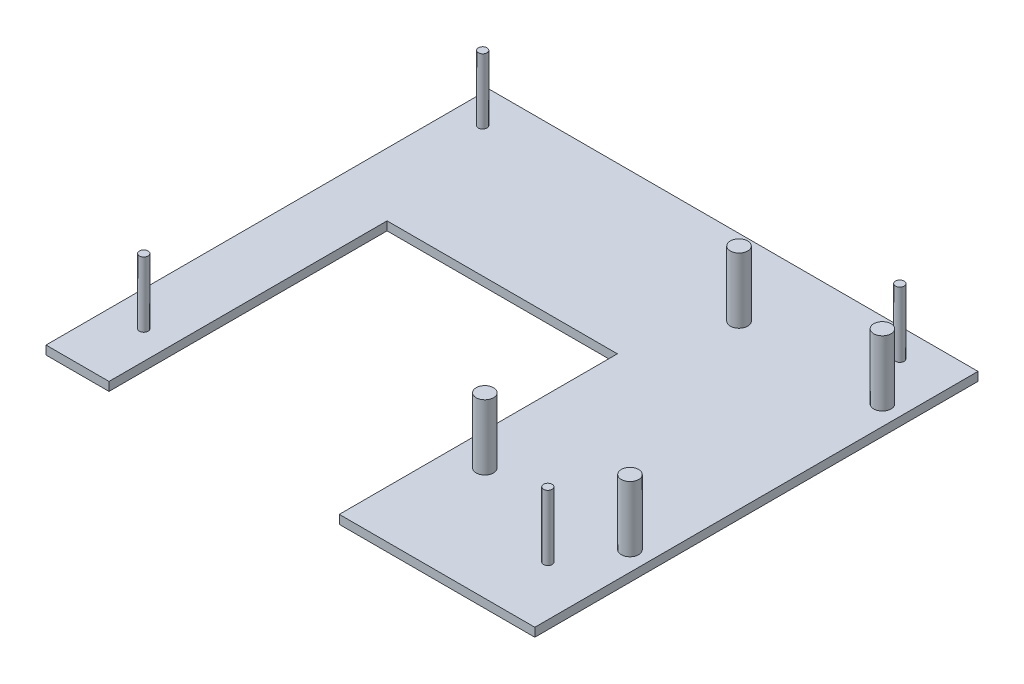
from build123d import *

# Parameters (mm, degrees)
SKETCH_1_W          = 120
SKETCH_1_H          = 120
EXTRUDE_1_DEPTH     = 2
SKETCH_2_R          = 2
SKETCH_2_R_2        = 1
EXTRUDE_2_DEPTH     = 15
SKETCH_3_W          = 53
SKETCH_3_H          = 18
SKETCH_3_W_2        = 45
SKETCH_3_W_3        = 14.5
SKETCH_3_W_4        = 7.5
SKETCH_3_H_2        = 13
SKETCH_3_H_3        = 89
CUT_EXTRUDE_3_DEPTH = 15
SKETCH_4_W          = 53
SKETCH_4_H          = 64
CUT_EXTRUDE_4_DEPTH = 15


with BuildPart() as part:
    # 스케치1 → 보스-돌출1 (new body)
    with BuildSketch(Plane(origin=(0, 0, 0), x_dir=(1, 0, 0), z_dir=(0, 1, 0))):
        Rectangle(SKETCH_1_W, SKETCH_1_H)
    extrude(amount=EXTRUDE_1_DEPTH)

    # 스케치2 → 보스-돌출2 (add)
    with BuildSketch(Plane(origin=(0, 2, 0), x_dir=(1, 0, 0), z_dir=(0, 1, 0))):
        with Locations(Location((55.5, 24.5, 0), (0, 0, 270))):
            Circle(SKETCH_2_R)
        with Locations(Location((55.5, -33.6, 0), (0, 0, 270))):
            Circle(SKETCH_2_R)
        with Locations(Location((48.5, -45.5, 0), (0, 0, 270))):
            Circle(SKETCH_2_R_2)
        with Locations(Location((22.5, -34, 0), (0, 0, 270))):
            Circle(SKETCH_2_R)
        with Locations(Location((22.5, 24.5, 0), (0, 0, 270))):
            Circle(SKETCH_2_R)
        with Locations(Location((48.5, 35.5, 0), (0, 0, 270))):
            Circle(SKETCH_2_R_2)
        with Locations(Location((-46, 34, 0), (0, 0, 270))):
            Circle(SKETCH_2_R_2)
        with Locations(Location((-44.5, -45.5, 0), (0, 0, 270))):
            Circle(SKETCH_2_R_2)
    extrude(amount=EXTRUDE_2_DEPTH)

    # 스케치3 → 컷-돌출3 (cut)
    with BuildSketch(Plane(origin=(0, 2, 0), x_dir=(1, 0, 0), z_dir=(0, 1, 0))):
        with Locations((-11.5, 51)):
            Rectangle(SKETCH_3_W, SKETCH_3_H)
        with Locations((37.5, 51)):
            Rectangle(SKETCH_3_W_2, SKETCH_3_H)
        with Locations((-45.25, 51)):
            Rectangle(SKETCH_3_W_3, SKETCH_3_H)
        with Locations((-56.25, 51)):
            Rectangle(SKETCH_3_W_4, SKETCH_3_H)
        with Locations((-56.25, 35.5)):
            Rectangle(SKETCH_3_W_4, SKETCH_3_H_2)
        with Locations((-56.25, -15.5)):
            Rectangle(SKETCH_3_W_4, SKETCH_3_H_3)
    extrude(amount=-CUT_EXTRUDE_3_DEPTH, mode=Mode.SUBTRACT)

    # 스케치4 → 컷-돌출4 (cut)
    with BuildSketch(Plane(origin=(0, 2, 0), x_dir=(1, 0, 0), z_dir=(0, 1, 0))):
        with Locations((-11.5, -28)):
            Rectangle(SKETCH_4_W, SKETCH_4_H)
    extrude(amount=-CUT_EXTRUDE_4_DEPTH, mode=Mode.SUBTRACT)


solid = part.part
